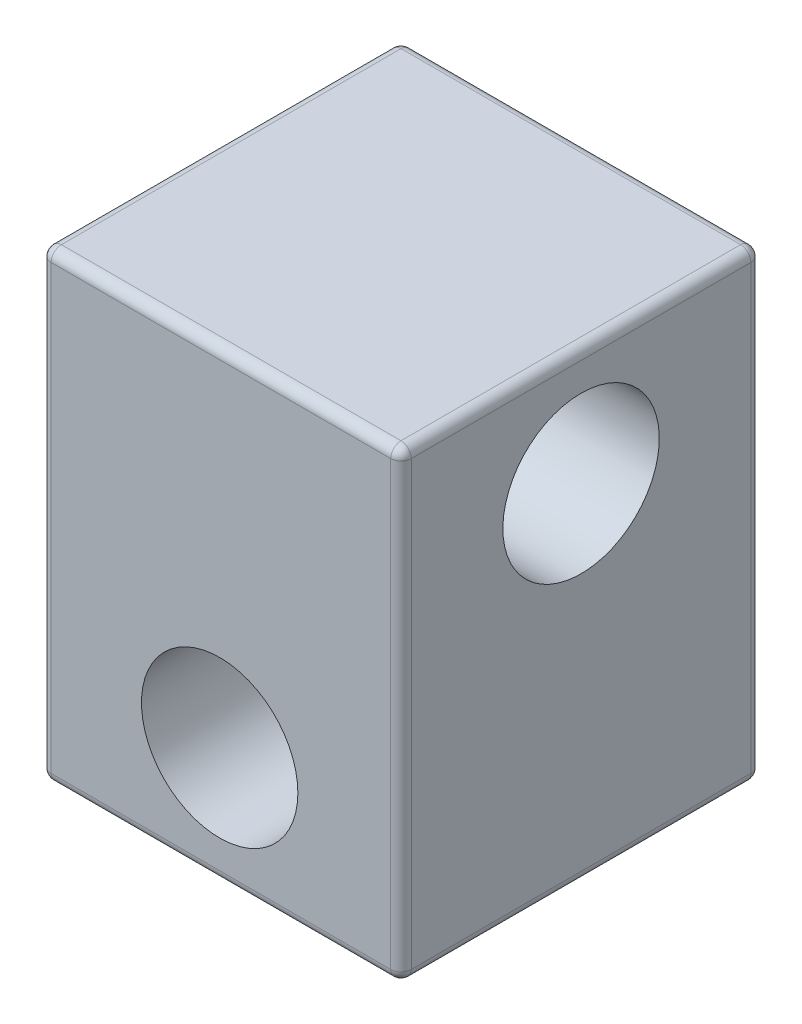
from build123d import *

# Parameters (mm, degrees)
SCHIZZO1_W                   = 35
SCHIZZO1_H                   = 45
SCHIZZO1_R                   = 7.6
ESTRUSIONE_ESTRUSIONE1_DEPTH = 35
SCHIZZO3_R                   = 7.6
TAGLIO_ESTRUSIONE1_DEPTH     = 35
RACCORDO1_R                  = 1


with BuildPart() as part:
    # Schizzo1 → Estrusione-Estrusione1 (new body)
    with BuildSketch(Plane.XY):
        with Locations((0.121961372, 0)):
            Rectangle(SCHIZZO1_W, SCHIZZO1_H)
        with Locations((0, -11.15)):
            Circle(SCHIZZO1_R, mode=Mode.SUBTRACT)
    extrude(amount=ESTRUSIONE_ESTRUSIONE1_DEPTH)

    # Schizzo3 → Taglio-Estrusione1 (cut)
    with BuildSketch(Plane(origin=(17.621961372, 0, 0), x_dir=(0, 0, -1), z_dir=(1, 0, 0))):
        with Locations(Location((-17.5, 11.15, 0), (0, 0, 90))):
            Circle(SCHIZZO3_R)
    extrude(amount=-TAGLIO_ESTRUSIONE1_DEPTH, mode=Mode.SUBTRACT)

    # Raccordo1
    raccordo1_edges = [part.edges().sort_by_distance(p)[0] for p in [
        (17.621961372, 0, 35),
        (0.121961372, 22.5, 35),
        (-17.378038628, 0, 35),
        (0.121961372, 22.5, 0),
        (17.621961372, 0, 0),
        (0.121961372, -22.5, 0),
        (-17.378038628, 0, 0),
        (0.121961372, -22.5, 35),
        (-17.378038628, 22.5, 17.5),
        (17.621961372, 22.5, 17.5),
        (17.621961372, -22.5, 17.5),
        (-17.378038628, -22.5, 17.5),
    ]]
    fillet(raccordo1_edges, radius=RACCORDO1_R)


solid = part.part
